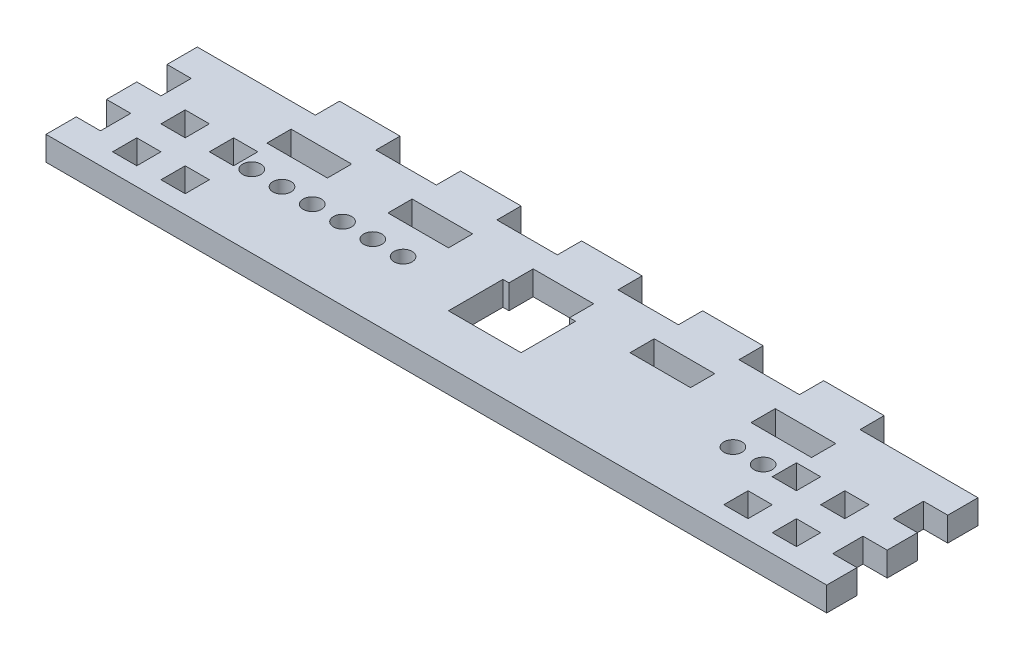
from build123d import *

# Parameters (mm, degrees)
SKETCH1_W           = 121
SKETCH1_H           = 25
BOSS_EXTRUDE1_DEPTH = 4
SKETCH2_W           = 4
SKETCH2_H           = 5
BOSS_EXTRUDE2_DEPTH = 4
LPATTERN1_COUNT     = 3
LPATTERN1_PITCH     = 10
SKETCH3_W           = 10
SKETCH3_H           = 4
BOSS_EXTRUDE3_DEPTH = 4
LPATTERN2_COUNT     = 3
LPATTERN2_PITCH     = 20
LPATTERN2_COL_COUNT = 3
LPATTERN2_COL_PITCH = 20
SKETCH4_W           = 10
SKETCH4_H           = 4
CUT_EXTRUDE1_DEPTH  = 128.538229563
SKETCH5_R           = 1.5
SKETCH5_W           = 12
SKETCH5_H           = 9
CUT_EXTRUDE2_DEPTH  = 128.538229563
SKETCH7_W           = 4
SKETCH7_H           = 4
CUT_EXTRUDE4_DEPTH  = 128.538229563


with BuildPart() as part:
    # Sketch1 → Boss-Extrude1 (new body)
    with BuildSketch(Plane(origin=(0, 0, 0), x_dir=(1, 0, 0), z_dir=(0, 1, 0))):
        with Locations((60.5, -12.5)):
            Rectangle(SKETCH1_W, SKETCH1_H)
    extrude(amount=BOSS_EXTRUDE1_DEPTH)

    # Sketch2 → Boss-Extrude2 (add, through all)
    with BuildSketch(Plane(origin=(0, 0, 0), x_dir=(-1, 0, 0), z_dir=(0, -1, 0))):
        with Locations((2, -22.5)):
            Rectangle(SKETCH2_W, SKETCH2_H)
        with Locations((-123, -22.5)):
            Rectangle(SKETCH2_W, SKETCH2_H)
    boss_extrude2 = extrude(amount=-BOSS_EXTRUDE2_DEPTH)

    # LPattern1: Boss-Extrude2 ×3
    with Locations(*[(0, 0, -i * LPATTERN1_PITCH) for i in range(1, LPATTERN1_COUNT)]):
        add(boss_extrude2)

    # Sketch3 → Boss-Extrude3 (add, through all)
    with BuildSketch(Plane(origin=(0, 0, 0), x_dir=(-1, 0, 0), z_dir=(0, -1, 0))):
        with Locations((-60.5, 2)):
            Rectangle(SKETCH3_W, SKETCH3_H)
    boss_extrude3 = extrude(amount=-BOSS_EXTRUDE3_DEPTH)

    # LPattern2: Boss-Extrude3 ×3
    with Locations(*[(i * LPATTERN2_PITCH, 0, 0) for i in range(1, LPATTERN2_COUNT)]):
        add(boss_extrude3)

    # LPattern2 col: Boss-Extrude3 ×3
    with Locations(*[(-i * LPATTERN2_COL_PITCH, 0, 0) for i in range(1, LPATTERN2_COL_COUNT)]):
        add(boss_extrude3)

    # Sketch4 → Cut-Extrude1 (cut, through all)
    with BuildSketch(Plane.XZ):
        with Locations((20.5, 6)):
            Rectangle(SKETCH4_W, SKETCH4_H)
        with Locations((40.5, 6)):
            Rectangle(SKETCH4_W, SKETCH4_H)
        with Locations((60.5, 6)):
            Rectangle(SKETCH4_W, SKETCH4_H)
        with Locations((80.5, 6)):
            Rectangle(SKETCH4_W, SKETCH4_H)
        with Locations((100.5, 6)):
            Rectangle(SKETCH4_W, SKETCH4_H)
    extrude(amount=-CUT_EXTRUDE1_DEPTH, mode=Mode.SUBTRACT)

    # Sketch5 → Cut-Extrude2 (cut, through all)
    with BuildSketch(Plane(origin=(0, 4, 0), x_dir=(1, 0, 0), z_dir=(0, 1, 0))):
        with Locations(Location((97.5, -13, 0), (0, 0, 270))):
            Circle(SKETCH5_R)
        with Locations(Location((102.5, -13, 0), (0, 0, 270))):
            Circle(SKETCH5_R)
        with Locations(Location((43, -13, 0), (0, 0, 270))):
            Circle(SKETCH5_R)
        with Locations(Location((38, -13, 0), (0, 0, 270))):
            Circle(SKETCH5_R)
        with Locations(Location((33, -13, 0), (0, 0, 270))):
            Circle(SKETCH5_R)
        with Locations(Location((28, -13, 0), (0, 0, 270))):
            Circle(SKETCH5_R)
        with Locations(Location((23, -13, 0), (0, 0, 270))):
            Circle(SKETCH5_R)
        with Locations(Location((18, -13, 0), (0, 0, 270))):
            Circle(SKETCH5_R)
        with Locations((60.5, -12.5)):
            Rectangle(SKETCH5_W, SKETCH5_H)
    extrude(amount=-CUT_EXTRUDE2_DEPTH, mode=Mode.SUBTRACT)

    # Sketch7 → Cut-Extrude4 (cut, through all)
    with BuildSketch(Plane.XZ):
        with Locations((6, 20)):
            Rectangle(SKETCH7_W, SKETCH7_H)
        with Locations((14, 20)):
            Rectangle(SKETCH7_W, SKETCH7_H)
        with Locations((6, 12)):
            Rectangle(SKETCH7_W, SKETCH7_H)
        with Locations((14, 12)):
            Rectangle(SKETCH7_W, SKETCH7_H)
        with Locations((107, 20)):
            Rectangle(SKETCH7_W, SKETCH7_H)
        with Locations((107, 12)):
            Rectangle(SKETCH7_W, SKETCH7_H)
        with Locations((115, 20)):
            Rectangle(SKETCH7_W, SKETCH7_H)
        with Locations((115, 12)):
            Rectangle(SKETCH7_W, SKETCH7_H)
    extrude(amount=-CUT_EXTRUDE4_DEPTH, mode=Mode.SUBTRACT)


solid = part.part
